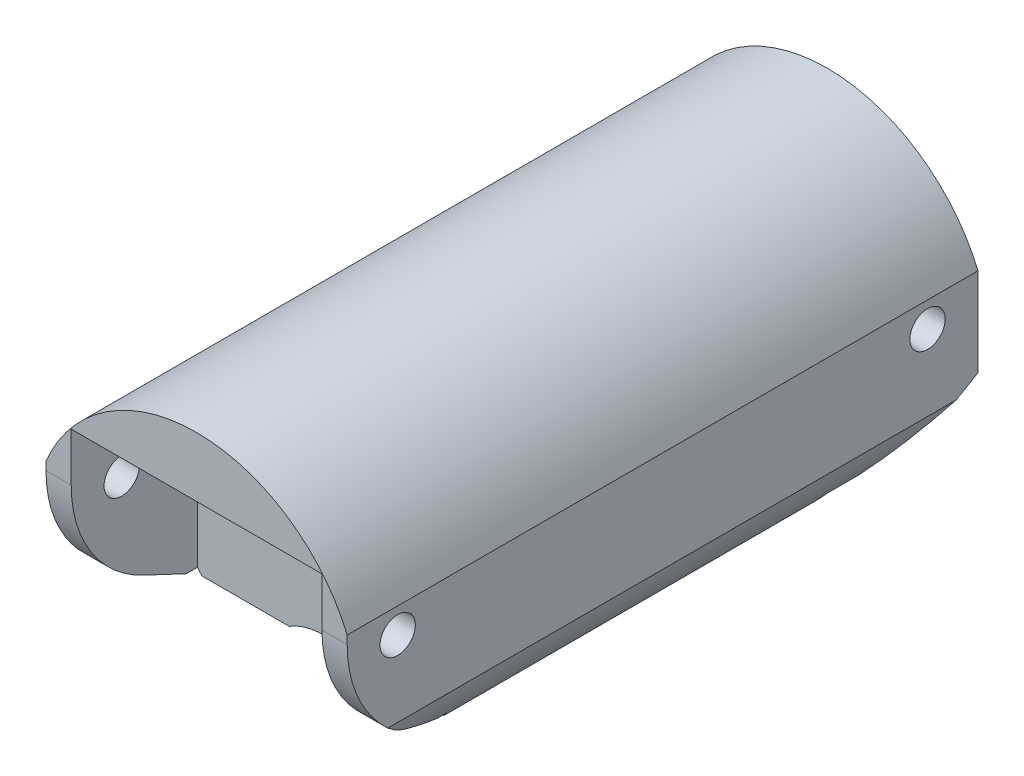
from build123d import *

# Parameters (mm, degrees)
BOSS_EXTRUDE1_DEPTH = 15.875
CUT_EXTRUDE1_DEPTH  = 25.170309552
CUT_EXTRUDE2_DEPTH  = 37.609435107
BOSS_EXTRUDE2_DEPTH = 15.15872
SKETCH6_W           = 12.61872
SKETCH6_H           = 6.35
CUT_EXTRUDE3_DEPTH  = 12.192
SKETCH7_R           = 0.889
CUT_EXTRUDE4_DEPTH  = 25.170309552
CUT_EXTRUDE5_DEPTH  = 15.875
FILLET1_R           = 6.35
CUT_EXTRUDE6_DEPTH  = 17.78
SKETCH10_W          = 0.284935898
SKETCH10_H          = 2.320192308
CUT_EXTRUDE7_DEPTH  = 1


with BuildPart() as part:
    # Sketch1 → Boss-Extrude1 (new, symmetric)
    with BuildSketch(Plane.XY):
        with BuildLine():
            Line((0, 0), (0, 5.08))
            ThreePointArc((0, 5.08), (7.57936, 10.11936), (15.15872, 5.08))
            Line((15.15872, 5.08), (15.15872, 0))
            ThreePointArc((15.15872, 0), (7.57936, -5.03936), (0, 0))
        make_face()
    extrude(amount=BOSS_EXTRUDE1_DEPTH, both=True)

    # Sketch2 → Cut-Extrude1 (cut, through all)
    with BuildSketch(Plane(origin=(0, 0, 0), x_dir=(0, 0, -1), z_dir=(1, 0, 0))):
        Polygon((-15.875, -5.03936), (-15.875, 0.635), (-3.81, -5.03936), align=None)
        Polygon((15.875, 0.635), (15.875, -5.03936), (6.04672018, -5.03936), align=None)
        with BuildLine():
            Line((-13.335, 1.27), (-15.875, 1.27))
            Line((-15.875, 1.27), (-15.875, 3.81))
            Line((-15.875, 3.81), (-13.335, 3.81))
            ThreePointArc((-13.335, 3.81), (-8.595295474, 2.54), (-13.335, 1.27))
        make_face()
        with BuildLine():
            Line((13.335, 1.27), (15.875, 1.27))
            Line((15.875, 1.27), (15.875, 3.81))
            Line((15.875, 3.81), (13.335, 3.81))
            ThreePointArc((13.335, 3.81), (8.595295474, 2.54), (13.335, 1.27))
        make_face()
    extrude(amount=CUT_EXTRUDE1_DEPTH, mode=Mode.SUBTRACT)

    # Sketch3 → Cut-Extrude2 (cut, through all)
    with BuildSketch(Plane.XY.offset(15.875)):
        with BuildLine():
            ThreePointArc((4.953709685, -3.254259045), (7.57936, -3.76936), (10.205010315, -3.254259045))
            ThreePointArc((10.205010315, -3.254259045), (7.57936, -1.86436), (4.953709685, -3.254259045))
        make_face()
    extrude(amount=-CUT_EXTRUDE2_DEPTH, mode=Mode.SUBTRACT)

    # Sketch4 → Boss-Extrude2 (add)
    with BuildSketch(Plane.ZY):
        with BuildLine():
            Line((15.875, 1.27), (13.335, 1.27))
            ThreePointArc((13.335, 1.27), (12.405295474, 0.340295474), (11.135295474, 0))
            ThreePointArc((11.135295474, 0), (8.595295474, 2.54), (11.135295474, 5.08))
            ThreePointArc((11.135295474, 5.08), (12.405295474, 4.739704526), (13.335, 3.81))
            Line((13.335, 3.81), (15.875, 3.81))
            Line((15.875, 3.81), (15.875, 1.27))
        make_face()
        with BuildLine():
            Line((-13.335, 1.27), (-15.875, 1.27))
            Line((-15.875, 1.27), (-15.875, 3.81))
            Line((-15.875, 3.81), (-13.335, 3.81))
            ThreePointArc((-13.335, 3.81), (-12.405295474, 4.739704526), (-11.135295474, 5.08))
            ThreePointArc((-11.135295474, 5.08), (-8.595295474, 2.54), (-11.135295474, 0))
            ThreePointArc((-11.135295474, 0), (-12.405295474, 0.340295474), (-13.335, 1.27))
        make_face()
    extrude(amount=-BOSS_EXTRUDE2_DEPTH)

    # Sketch6 → Cut-Extrude3 (cut)
    with BuildSketch(Plane(origin=(0, -5.08, 0), x_dir=(1, 0, 0), z_dir=(0, 1, 0))):
        with Locations((7.57936, -12.7)):
            Rectangle(SKETCH6_W, SKETCH6_H)
        with Locations((7.57936, 12.7)):
            Rectangle(SKETCH6_W, SKETCH6_H)
    extrude(amount=CUT_EXTRUDE3_DEPTH, mode=Mode.SUBTRACT)

    # Sketch7 → Cut-Extrude4 (cut, through all)
    with BuildSketch(Plane.ZY):
        with Locations((13.335, 3.81)):
            Circle(SKETCH7_R)
        with Locations(Location((-13.335, 3.81, 0), (0, 0, 180))):
            Circle(SKETCH7_R)
    extrude(amount=-CUT_EXTRUDE4_DEPTH, mode=Mode.SUBTRACT)

    # Sketch8 → Cut-Extrude5 (cut)
    with BuildSketch(Plane(origin=(0, 0, -9.525), x_dir=(-1, 0, 0), z_dir=(0, 0, -1))):
        with BuildLine():
            Line((-4.91236, 6.87324), (-5.54736, 6.87324))
            ThreePointArc((-5.54736, 6.87324), (-5.92836, 6.49224), (-5.54736, 6.11124))
            Line((-5.54736, 6.11124), (-4.91236, 6.11124))
            ThreePointArc((-4.91236, 6.11124), (-4.53136, 6.49224), (-4.91236, 6.87324))
        make_face()
    extrude(amount=-CUT_EXTRUDE5_DEPTH, mode=Mode.SUBTRACT)

    # Fillet1
    fillet1_edges = [part.edges().sort_by_distance(p)[0] for p in [
        (0.635, 0.635, 15.875),
        (14.52372, 0.635, 15.875),
    ]]
    fillet(fillet1_edges, radius=FILLET1_R)

    # Sketch9 → Cut-Extrude6 (cut)
    with BuildSketch(Plane.XY.offset(9.525)):
        with BuildLine():
            Line((9.61136, 6.767094737), (10.24636, 6.767094737))
            ThreePointArc((10.24636, 6.767094737), (10.62736, 6.386094737), (10.24636, 6.005094737))
            Line((10.24636, 6.005094737), (9.61136, 6.005094737))
            ThreePointArc((9.61136, 6.005094737), (9.23036, 6.386094737), (9.61136, 6.767094737))
        make_face()
    extrude(amount=-CUT_EXTRUDE6_DEPTH, mode=Mode.SUBTRACT)

    # Sketch10 → Cut-Extrude7 (cut)
    # profile 1 of 9: a face of its own
    with BuildSketch(Plane.ZY):
        with BuildLine():
            Line((-9.132963094, 3.918079484), (-8.510301836, 3.918079484))
            add(Edge.make_bspline(
                [(-8.510301836, 3.918079484), (-8.4674748, 3.918032407), (-8.385416296, 3.917942204), (-8.26774621, 3.915207399), (-8.160875953, 3.911554614), (-8.065035965, 3.90649104), (-7.979931362, 3.90050699), (-7.90594724, 3.892114069), (-7.842502071, 3.883350801), (-7.804486935, 3.874441382), (-7.787149793, 3.870378162)],
                knots=[0, 0, 0, 0, 1.415646017, 2.712440637, 3.8905458, 4.950247383, 5.884950622, 6.709939814, 7.411656543, 8, 8, 8, 8], degree=3))
            add(Edge.make_bspline(
                [(-7.787149793, 3.870378162), (-7.765202801, 3.864371107), (-7.721825972, 3.852498547), (-7.659322883, 3.828718955), (-7.59985618, 3.800522991), (-7.543221838, 3.768388417), (-7.490115805, 3.730936512), (-7.439745754, 3.689685445), (-7.3925562, 3.643682808), (-7.348812509, 3.593444565), (-7.308639871, 3.539814089), (-7.274050802, 3.48199078), (-7.245088246, 3.420947955), (-7.220247707, 3.356728073), (-7.202369323, 3.288791851), (-7.188901064, 3.217611333), (-7.180352488, 3.14319415), (-7.179533735, 3.092339841), (-7.17911694, 3.06645188)],
                knots=[0, 0, 0, 0, 0.999701418, 1.975846123, 2.934577507, 3.890451536, 4.834027766, 5.787354733, 6.749476667, 7.726910423, 8.712836071, 9.690891519, 10.682875813, 11.679750201, 12.712814741, 13.765529915, 14.8625177, 16, 16, 16, 16], degree=3))
            add(Edge.make_bspline(
                [(-7.17911694, 3.06645188), (-7.179499233, 3.040346325), (-7.180247213, 2.989269044), (-7.189224558, 2.914545158), (-7.201316946, 2.843136333), (-7.219910701, 2.775200902), (-7.244263561, 2.711142311), (-7.272831352, 2.649981622), (-7.30728784, 2.592759348), (-7.346879936, 2.539267748), (-7.390923168, 2.489456614), (-7.43923119, 2.443686907), (-7.491608977, 2.402226543), (-7.547890069, 2.364982574), (-7.608623146, 2.332818663), (-7.672887099, 2.304010251), (-7.74124051, 2.279815789), (-7.788541219, 2.267088519), (-7.812590498, 2.260617545)],
                knots=[0, 0, 0, 0, 1.121902311, 2.195077645, 3.232258892, 4.234102512, 5.217864754, 6.176164875, 7.132989551, 8.084763148, 9.034132444, 9.988522005, 10.94243251, 11.903244335, 12.886203696, 13.894208494, 14.929344452, 16, 16, 16, 16], degree=3))
            add(Edge.make_bspline(
                [(-7.812590498, 2.260617545), (-7.832481722, 2.256387555), (-7.876074497, 2.247117286), (-7.947868252, 2.236768186), (-8.031457281, 2.227934791), (-8.126727492, 2.221311616), (-8.23359337, 2.215641639), (-8.352112725, 2.211134868), (-8.482518209, 2.208658501), (-8.573478552, 2.208530781), (-8.620968903, 2.208464099)],
                knots=[0, 0, 0, 0, 0.601384939, 1.31797006, 2.144135048, 3.087295005, 4.142315834, 5.309527816, 6.595305764, 8, 8, 8, 8], degree=3))
            Line((-8.620968903, 2.208464099), (-8.848027196, 2.208464099))
            Line((-8.848027196, 2.208464099), (-8.848027196, 0.743079484))
            Line((-8.848027196, 0.743079484), (-9.132963094, 0.743079484))
            Line((-9.132963094, 0.743079484), (-9.132963094, 3.918079484))
        make_face()
        with BuildLine():
            Line((-8.848027196, 3.592438458), (-8.848027196, 2.534105125))
            Line((-8.848027196, 2.534105125), (-8.292147789, 2.527108931))
            add(Edge.make_bspline(
                [(-8.292147789, 2.527108931), (-8.265006142, 2.527094903), (-8.212609753, 2.527067823), (-8.136921179, 2.53068299), (-8.066699897, 2.534856331), (-8.002161603, 2.540966775), (-7.943277205, 2.549603916), (-7.889948519, 2.558323136), (-7.842589055, 2.570937286), (-7.78716335, 2.587921784), (-7.725402028, 2.616889229), (-7.65821218, 2.6589352), (-7.601270291, 2.712529843), (-7.551995836, 2.772789375), (-7.512892647, 2.839826443), (-7.484266854, 2.911553264), (-7.467447376, 2.987234242), (-7.465192043, 3.039021339), (-7.464052838, 3.065179845)],
                knots=[0, 0, 0, 0, 1.160613943, 2.240541288, 3.23993089, 4.169200891, 5.011653406, 5.7853311, 6.478053781, 7.106038997, 8.262395093, 9.384106736, 10.481365981, 11.59014053, 12.70357646, 13.786202915, 14.881775077, 16, 16, 16, 16], degree=3))
            add(Edge.make_bspline(
                [(-7.464052838, 3.065179845), (-7.465198238, 3.090705496), (-7.467475153, 3.141447332), (-7.484398686, 3.215813779), (-7.512836992, 3.28678474), (-7.552258332, 3.352981753), (-7.600102071, 3.413024453), (-7.655709332, 3.465182562), (-7.718949219, 3.507112249), (-7.777775829, 3.534175297), (-7.830028333, 3.550699154), (-7.875414468, 3.562260545), (-7.92665958, 3.571491274), (-7.983780352, 3.57896568), (-8.046334051, 3.585364177), (-8.114858094, 3.589705742), (-8.189092899, 3.592247063), (-8.240628202, 3.592373115), (-8.267343102, 3.592438458)],
                knots=[0, 0, 0, 0, 1.120700087, 2.227813068, 3.331159281, 4.466773991, 5.599788987, 6.693661531, 7.80175334, 8.91857717, 9.525282508, 10.207424825, 10.974604443, 11.810962634, 12.737642355, 13.736264703, 14.826523623, 16, 16, 16, 16], degree=3))
            Line((-8.267343102, 3.592438458), (-8.848027196, 3.592438458))
        make_face(mode=Mode.SUBTRACT)
    # profile 2 of 9: a face of its own
    with BuildSketch(Plane.ZY):
        with BuildLine():
            add(Edge.make_bspline(
                [(-5.488582084, 3.10397692), (-5.445047144, 3.103049919), (-5.359685765, 3.101232296), (-5.234674326, 3.081805863), (-5.115344095, 3.052099325), (-5.00123805, 3.011031551), (-4.893817553, 2.955984353), (-4.791517925, 2.890298782), (-4.694619638, 2.812481714), (-4.636541604, 2.752285467), (-4.607061652, 2.721730325)],
                knots=[0, 0, 0, 0, 1.054011418, 2.066658804, 3.057071809, 4.030435133, 4.997543892, 5.974964718, 6.972108034, 8, 8, 8, 8], degree=3))
            add(Edge.make_bspline(
                [(-4.607061652, 2.721730325), (-4.581678022, 2.692507638), (-4.531402005, 2.634627803), (-4.466935246, 2.540778783), (-4.411398545, 2.443587406), (-4.366891431, 2.341763046), (-4.331798588, 2.236194594), (-4.306883278, 2.126519198), (-4.292063344, 2.012979069), (-4.290064938, 1.935868444), (-4.289052838, 1.896815462)],
                knots=[0, 0, 0, 0, 1.025258237, 2.030674902, 3.01204498, 3.988269485, 4.97094183, 5.956517959, 6.965070386, 8, 8, 8, 8], degree=3))
            add(Edge.make_bspline(
                [(-4.289052838, 1.896815462), (-4.289943051, 1.857536124), (-4.291702153, 1.77991832), (-4.308342434, 1.665600752), (-4.334224205, 1.554752592), (-4.371264515, 1.447837919), (-4.4187608, 1.344529926), (-4.476718781, 1.245279835), (-4.545545176, 1.149891828), (-4.623563088, 1.059175875), (-4.709788718, 0.975567952), (-4.803329795, 0.902698736), (-4.902348098, 0.840267781), (-5.008160282, 0.789979033), (-5.119800074, 0.75032809), (-5.237508271, 0.72247879), (-5.361102014, 0.705640691), (-5.445490993, 0.70347845), (-5.488582084, 0.702374356)],
                knots=[0, 0, 0, 0, 0.998656419, 1.973391657, 2.932242238, 3.890759089, 4.846373663, 5.82037756, 6.809684879, 7.83454468, 8.860553229, 9.859544525, 10.845671541, 11.83227036, 12.833544569, 13.85385346, 14.904124723, 16, 16, 16, 16], degree=3))
            add(Edge.make_bspline(
                [(-5.488582084, 0.702374356), (-5.531884294, 0.703482155), (-5.61669386, 0.705651836), (-5.740723858, 0.722413371), (-5.858643012, 0.750315256), (-5.970428955, 0.790109338), (-6.076696066, 0.840269389), (-6.176288103, 0.902509993), (-6.269905169, 0.975589562), (-6.35614904, 1.059170019), (-6.434162061, 1.149893337), (-6.502989719, 1.245279443), (-6.560947372, 1.344530028), (-6.608443742, 1.447837892), (-6.64548403, 1.554752599), (-6.671365807, 1.66560075), (-6.688006085, 1.77991832), (-6.689765188, 1.857536124), (-6.690655402, 1.896815462)],
                knots=[0, 0, 0, 0, 1.099876186, 2.154163076, 3.173186993, 4.173200201, 5.163417411, 6.152872554, 7.150605724, 8.17532212, 9.198891216, 10.186952605, 11.159729845, 12.11414092, 13.071450619, 14.029093627, 15.002601286, 16, 16, 16, 16], degree=3))
            add(Edge.make_bspline(
                [(-6.690655402, 1.896815462), (-6.689636399, 1.935656185), (-6.687618948, 2.012554143), (-6.672813915, 2.125880834), (-6.647995796, 2.235370608), (-6.612860886, 2.340531576), (-6.567943534, 2.441909721), (-6.513187223, 2.539341247), (-6.448062863, 2.632765894), (-6.397986807, 2.690570924), (-6.372646588, 2.719822272)],
                knots=[0, 0, 0, 0, 1.031353054, 2.041901799, 3.029428768, 4.008703097, 4.981709435, 5.96992636, 6.972712378, 8, 8, 8, 8], degree=3))
            add(Edge.make_bspline(
                [(-6.372646588, 2.719822272), (-6.34321108, 2.750642396), (-6.285320975, 2.811255592), (-6.187940343, 2.88884581), (-6.085892377, 2.955898248), (-5.977284765, 3.009851672), (-5.863272459, 3.052340899), (-5.743330717, 3.081882474), (-5.617895071, 3.101162303), (-5.532115986, 3.103029364), (-5.488582084, 3.10397692)],
                knots=[0, 0, 0, 0, 1.027980169, 2.021703884, 2.998553061, 3.971491411, 4.943284454, 5.930300938, 6.949603206, 8, 8, 8, 8], degree=3))
        make_face()
        with BuildLine():
            add(Edge.make_bspline(
                [(-5.48985412, 2.819041022), (-5.520640381, 2.818166), (-5.581418162, 2.816438544), (-5.670880214, 2.803299573), (-5.757004497, 2.782482909), (-5.839954405, 2.752906372), (-5.919450212, 2.714716656), (-5.995568027, 2.667809787), (-6.06853174, 2.612807033), (-6.13691404, 2.549794467), (-6.199672281, 2.480961379), (-6.254534445, 2.407620368), (-6.301184363, 2.330961039), (-6.340046507, 2.250903676), (-6.368990885, 2.166636987), (-6.390012127, 2.079115271), (-6.403138702, 1.988160215), (-6.404849917, 1.926328434), (-6.405719504, 1.894907409)],
                knots=[0, 0, 0, 0, 1.021534396, 2.016698045, 2.994645724, 3.958388632, 4.93408049, 5.916473867, 6.921342795, 7.962252576, 8.998418191, 10.008913653, 10.997312074, 11.973003931, 12.956656626, 13.948281152, 14.957379055, 16, 16, 16, 16], degree=3))
            add(Edge.make_bspline(
                [(-6.405719504, 1.894907409), (-6.404261886, 1.854310927), (-6.401368785, 1.773734502), (-6.377841821, 1.655070126), (-6.338484267, 1.541149446), (-6.285337235, 1.432640296), (-6.218747308, 1.332244729), (-6.140291183, 1.242735597), (-6.050810883, 1.165459897), (-5.951373058, 1.101342273), (-5.844008784, 1.050397351), (-5.730383407, 1.014293995), (-5.611873635, 0.990824674), (-5.530883257, 0.988491979), (-5.48985412, 0.987310253)],
                knots=[0, 0, 0, 0, 1.016792936, 2.018143844, 3.017858371, 4.030088057, 5.03801393, 6.028138512, 7.003788237, 7.991172063, 8.984598303, 9.972568034, 10.972917682, 12, 12, 12, 12], degree=3))
            add(Edge.make_bspline(
                [(-5.48985412, 0.987310253), (-5.448827342, 0.988498865), (-5.367841623, 0.99084515), (-5.249496512, 1.014175794), (-5.136181695, 1.050555543), (-5.028928936, 1.101284977), (-4.929536375, 1.165703381), (-4.839412529, 1.242299238), (-4.761626289, 1.332481803), (-4.695102233, 1.432773276), (-4.641084831, 1.540981224), (-4.601911498, 1.655091152), (-4.578327973, 1.773729147), (-4.575442507, 1.854309133), (-4.573988735, 1.894907409)],
                knots=[0, 0, 0, 0, 1.02726834, 2.027799167, 3.010890988, 4.004497153, 4.992059811, 5.971914811, 6.958719428, 7.966827853, 8.981595046, 9.981490638, 10.983022906, 12, 12, 12, 12], degree=3))
            add(Edge.make_bspline(
                [(-4.573988735, 1.894907409), (-4.574858023, 1.926328622), (-4.576568648, 1.988160772), (-4.589699509, 2.079113141), (-4.610704891, 2.166644803), (-4.639707716, 2.250874835), (-4.678401, 2.331168321), (-4.725950519, 2.407395288), (-4.780588664, 2.48121544), (-4.844104195, 2.549571957), (-4.912415116, 2.612831598), (-4.985408401, 2.667831115), (-5.061413345, 2.714510505), (-5.140678203, 2.753233023), (-5.223638746, 2.782213825), (-5.309642356, 2.803419769), (-5.398722705, 2.816383019), (-5.459282694, 2.818149355), (-5.48985412, 2.819041022)],
                knots=[0, 0, 0, 0, 1.042956736, 2.052379634, 3.044323526, 4.02829302, 5.004299113, 5.996692471, 7.007513377, 8.048758398, 9.090003419, 10.095195979, 11.07790575, 12.047570684, 13.018257071, 13.989683339, 14.985167495, 16, 16, 16, 16], degree=3))
        make_face(mode=Mode.SUBTRACT)
    # profile 3 of 9: a face of its own
    with BuildSketch(Plane.ZY):
        with BuildLine():
            add(Edge.make_bspline(
                [(-3.618690257, 4.040194869), (-3.601008849, 4.039374673), (-3.566385257, 4.037768573), (-3.516317078, 4.024014947), (-3.470726789, 4.000701661), (-3.430288417, 3.969423665), (-3.395588491, 3.932639527), (-3.371294561, 3.889767077), (-3.355680459, 3.843449598), (-3.353794912, 3.811141624), (-3.352834889, 3.794692064)],
                knots=[0, 0, 0, 0, 1.055194115, 2.066272739, 3.074728998, 4.095836921, 5.109056067, 6.073838105, 7.019297344, 8, 8, 8, 8], degree=3))
            add(Edge.make_bspline(
                [(-3.352834889, 3.794692064), (-3.353816562, 3.778669514), (-3.355757215, 3.74699483), (-3.371282501, 3.701480323), (-3.395795531, 3.65920358), (-3.430266166, 3.622490865), (-3.470732685, 3.591230159), (-3.516315512, 3.567912289), (-3.566385669, 3.554159879), (-3.601008989, 3.552553611), (-3.618690257, 3.55173333)],
                knots=[0, 0, 0, 0, 0.96129708, 1.900370562, 2.859976407, 3.87933698, 4.906634145, 5.921202961, 6.938410037, 8, 8, 8, 8], degree=3))
            add(Edge.make_bspline(
                [(-3.618690257, 3.55173333), (-3.636169336, 3.552522291), (-3.670190078, 3.554057899), (-3.71950857, 3.56818213), (-3.764710129, 3.591238139), (-3.805227367, 3.622286178), (-3.839000471, 3.659429049), (-3.863582523, 3.701454523), (-3.879071953, 3.747001399), (-3.881017438, 3.778671721), (-3.882001555, 3.794692064)],
                knots=[0, 0, 0, 0, 1.054934014, 2.053291228, 3.073705704, 4.106921865, 5.123545215, 6.088680038, 7.033164197, 8, 8, 8, 8], degree=3))
            add(Edge.make_bspline(
                [(-3.882001555, 3.794692064), (-3.881038998, 3.811139335), (-3.879148475, 3.843442812), (-3.863570913, 3.889793306), (-3.83920523, 3.93241224), (-3.805205005, 3.969628229), (-3.76471608, 4.00069373), (-3.719507033, 4.023745121), (-3.670190484, 4.03787055), (-3.636169473, 4.039405993), (-3.618690257, 4.040194869)],
                knots=[0, 0, 0, 0, 0.98631895, 1.937192651, 2.907499808, 3.917963147, 4.944918757, 5.95915025, 6.951458133, 8, 8, 8, 8], degree=3))
        make_face()
    # profile 4 of 9: a face of its own
    with BuildSketch(Plane.ZY):
        with Locations((-3.617418222, 1.903175638)):
            Rectangle(SKETCH10_W, SKETCH10_H)
    # profile 5 of 9: a face of its own
    with BuildSketch(Plane.ZY):
        with BuildLine():
            Line((-2.782963094, 3.063271792), (-2.498027196, 3.063271792))
            Line((-2.498027196, 3.063271792), (-2.498027196, 2.644772192))
            add(Edge.make_bspline(
                [(-2.498027196, 2.644772192), (-2.46760377, 2.682729519), (-2.40856605, 2.756387037), (-2.310245977, 2.853197844), (-2.206338296, 2.932976727), (-2.097479335, 2.996570883), (-1.983521319, 3.044510322), (-1.865158888, 3.079132274), (-1.741683405, 3.099892083), (-1.657714237, 3.102604649), (-1.615234729, 3.10397692)],
                knots=[0, 0, 0, 0, 1.12780773, 2.188550248, 3.19190651, 4.159438251, 5.104880172, 6.052711206, 7.014878035, 8, 8, 8, 8], degree=3))
            add(Edge.make_bspline(
                [(-1.615234729, 3.10397692), (-1.572299082, 3.102393778), (-1.488263665, 3.099295188), (-1.365909995, 3.07478719), (-1.25163413, 3.032926851), (-1.145843533, 2.975584473), (-1.050478133, 2.904277172), (-0.966726303, 2.821203042), (-0.897453929, 2.725648166), (-0.851010607, 2.636999303), (-0.820416626, 2.558360183), (-0.801155863, 2.491007774), (-0.784799187, 2.415970594), (-0.770618958, 2.333475395), (-0.761024007, 2.24294418), (-0.753456357, 2.144748059), (-0.748032827, 2.03891884), (-0.747817646, 1.965724543), (-0.747706684, 1.927980325)],
                knots=[0, 0, 0, 0, 1.235846778, 2.418850247, 3.575807741, 4.728682307, 5.871620074, 6.994088408, 8.11269785, 9.256955736, 9.865816715, 10.540099792, 11.271859618, 12.076849838, 12.949306005, 13.892391288, 14.913166135, 16, 16, 16, 16], degree=3))
            Line((-0.747706684, 1.927980325), (-0.747706684, 0.743079484))
            Line((-0.747706684, 0.743079484), (-1.032642581, 0.743079484))
            Line((-1.032642581, 0.743079484), (-1.032642581, 1.834485734))
            add(Edge.make_bspline(
                [(-1.032642581, 1.834485734), (-1.032817848, 1.866074666), (-1.033153105, 1.926498917), (-1.034210513, 2.013012246), (-1.036759409, 2.091467927), (-1.040341093, 2.161678396), (-1.045583499, 2.223576234), (-1.051046886, 2.277287506), (-1.057727972, 2.32274402), (-1.063681472, 2.350108059), (-1.066351515, 2.362380365)],
                knots=[0, 0, 0, 0, 1.430800155, 2.736877192, 3.918605307, 4.986035426, 5.920637409, 6.731861385, 7.431261377, 8, 8, 8, 8], degree=3))
            add(Edge.make_bspline(
                [(-1.066351515, 2.362380365), (-1.07599039, 2.398404083), (-1.094542243, 2.467738594), (-1.140383784, 2.561786043), (-1.198272363, 2.641794399), (-1.26893684, 2.707268996), (-1.351694645, 2.75822397), (-1.446316124, 2.793578914), (-1.551888177, 2.815691673), (-1.626141795, 2.817893428), (-1.664844104, 2.819041022)],
                knots=[0, 0, 0, 0, 1.084156227, 2.086665306, 3.027808233, 3.945421172, 4.874247719, 5.839848303, 6.874090471, 8, 8, 8, 8], degree=3))
            add(Edge.make_bspline(
                [(-1.664844104, 2.819041022), (-1.687765502, 2.818609218), (-1.733126358, 2.817754689), (-1.800390975, 2.809181011), (-1.865636475, 2.795157984), (-1.929517665, 2.776227148), (-1.990756878, 2.750226375), (-2.051321628, 2.72071759), (-2.108931335, 2.683934569), (-2.164814417, 2.642940219), (-2.216805321, 2.597511224), (-2.265181742, 2.549573704), (-2.308305518, 2.498523692), (-2.347374959, 2.44518374), (-2.381100955, 2.388821287), (-2.410540542, 2.329980095), (-2.435519351, 2.268582717), (-2.447931508, 2.225969625), (-2.45414198, 2.204647994)],
                knots=[0, 0, 0, 0, 1.023777757, 2.026029729, 3.023749952, 4.003683103, 4.997618607, 5.993177895, 7.010360494, 8.046726602, 9.087585522, 10.09234134, 11.086953743, 12.070360549, 13.043493632, 14.017870808, 15.008233677, 16, 16, 16, 16], degree=3))
            add(Edge.make_bspline(
                [(-2.45414198, 2.204647994), (-2.457715804, 2.188995059), (-2.465495832, 2.15491944), (-2.47389886, 2.098999146), (-2.481525732, 2.034310811), (-2.487909258, 1.960929924), (-2.491814886, 1.878599566), (-2.496073375, 1.787671341), (-2.497623737, 1.687782677), (-2.497888944, 1.61823957), (-2.498027196, 1.581986736)],
                knots=[0, 0, 0, 0, 0.615963638, 1.340920617, 2.168419149, 3.115676021, 4.16674242, 5.331190069, 6.6087489, 8, 8, 8, 8], degree=3))
            Line((-2.498027196, 1.581986736), (-2.498027196, 0.743079484))
            Line((-2.498027196, 0.743079484), (-2.782963094, 0.743079484))
            Line((-2.782963094, 0.743079484), (-2.782963094, 3.063271792))
        make_face()
    # profile 6 of 9: a face of its own
    with BuildSketch(Plane.ZY):
        Polygon((0.188511265, 3.99948974), (0.473447162, 3.99948974), (0.473447162, 3.063271792), (0.880498445, 3.063271792), (0.880498445, 2.778335894), (0.473447162, 2.778335894), (0.473447162, 0.743079484), (0.188511265, 0.743079484), (0.188511265, 2.778335894), (-0.218540017, 2.778335894), (-0.218540017, 3.063271792), (0.188511265, 3.063271792), align=None)
    # profile 7 of 9: a face of its own
    with BuildSketch(Plane.ZY):
        with BuildLine():
            Line((3.273196762, 1.475771792), (3.526331778, 1.342844107))
            add(Edge.make_bspline(
                [(3.526331778, 1.342844107), (3.506160009, 1.307063371), (3.466913736, 1.237448228), (3.399421629, 1.141806469), (3.328671677, 1.055766041), (3.251470221, 0.981625569), (3.170127012, 0.916990384), (3.084190961, 0.860441071), (2.993214676, 0.812254985), (2.897193854, 0.771658049), (2.795322119, 0.740443722), (2.6873526, 0.718396322), (2.573078458, 0.704768071), (2.494750138, 0.703184979), (2.454642074, 0.702374356)],
                knots=[0, 0, 0, 0, 1.120438281, 2.179929193, 3.190490725, 4.156257408, 5.095198341, 6.022838206, 6.959905092, 7.901321166, 8.864066838, 9.862729781, 10.905609505, 12, 12, 12, 12], degree=3))
            add(Edge.make_bspline(
                [(2.454642074, 0.702374356), (2.41006328, 0.703415008), (2.323102968, 0.705445018), (2.196520483, 0.722946039), (2.077340582, 0.751495965), (1.965569966, 0.791378992), (1.861482351, 0.843473779), (1.764870861, 0.906937023), (1.675227434, 0.981442711), (1.595376901, 1.067636199), (1.523491379, 1.15987626), (1.460058671, 1.255993384), (1.40702943, 1.355745738), (1.363892419, 1.458498284), (1.32905372, 1.563603388), (1.304772496, 1.672017362), (1.290775511, 1.783446785), (1.288630621, 1.858827939), (1.287549727, 1.896815462)],
                knots=[0, 0, 0, 0, 1.145258523, 2.234067595, 3.276747158, 4.290159414, 5.277019952, 6.260822364, 7.254936242, 8.264827045, 9.274100331, 10.257902744, 11.220704747, 12.172965371, 13.118907548, 14.062713208, 15.023725156, 16, 16, 16, 16], degree=3))
            add(Edge.make_bspline(
                [(1.287549727, 1.896815462), (1.288510519, 1.932461486), (1.290414683, 2.0031072), (1.302416897, 2.107669515), (1.323687849, 2.209295326), (1.352876371, 2.308069075), (1.390569287, 2.403825382), (1.436681372, 2.496622526), (1.491284458, 2.58636176), (1.533441812, 2.642970317), (1.55467713, 2.671484933)],
                knots=[0, 0, 0, 0, 1.024358464, 2.0301432, 3.019427413, 4.004406732, 4.986367066, 5.972626655, 6.978780325, 8, 8, 8, 8], degree=3))
            add(Edge.make_bspline(
                [(1.55467713, 2.671484933), (1.583440528, 2.705837408), (1.640056173, 2.773454158), (1.735810867, 2.862298211), (1.839497473, 2.936723636), (1.949816591, 2.998415824), (2.068050393, 3.045291203), (2.192609535, 3.080223081), (2.324912317, 3.09979742), (2.415359196, 3.102562241), (2.461638268, 3.10397692)],
                knots=[0, 0, 0, 0, 1.030682036, 2.02871468, 2.997146059, 3.962720338, 4.930598197, 5.918074684, 6.934738563, 8, 8, 8, 8], degree=3))
            add(Edge.make_bspline(
                [(2.461638268, 3.10397692), (2.509215739, 3.102748604), (2.60255189, 3.100338929), (2.738652457, 3.077999326), (2.867431107, 3.04257308), (2.988836308, 2.992540713), (3.102880367, 2.927988834), (3.208821998, 2.848031592), (3.308473013, 2.755123756), (3.366447224, 2.683674273), (3.395948164, 2.647316263)],
                knots=[0, 0, 0, 0, 1.056321875, 2.072262726, 3.055038591, 4.01806755, 4.982017516, 5.957941055, 6.960871419, 8, 8, 8, 8], degree=3))
            add(Edge.make_bspline(
                [(3.395948164, 2.647316263), (3.416020458, 2.6199173), (3.456031439, 2.565301749), (3.506148451, 2.476246485), (3.549652659, 2.383073303), (3.584426131, 2.284276105), (3.612583393, 2.181025486), (3.632954936, 2.07258332), (3.644901661, 1.958981901), (3.64724998, 1.881578526), (3.648447162, 1.842117946)],
                knots=[0, 0, 0, 0, 0.94817472, 1.890038105, 2.849395472, 3.817997239, 4.812318967, 5.836947057, 6.897266129, 8, 8, 8, 8], degree=3))
            Line((3.648447162, 1.842117946), (1.572485624, 1.842117946))
            add(Edge.make_bspline(
                [(1.572485624, 1.842117946), (1.573882267, 1.81154681), (1.576628709, 1.751429905), (1.58943316, 1.663463552), (1.609615977, 1.579667735), (1.637981483, 1.500670975), (1.672332122, 1.425441502), (1.714410593, 1.354537369), (1.764611474, 1.288281532), (1.820605502, 1.226081343), (1.882932652, 1.17069051), (1.94850343, 1.121113541), (2.018256879, 1.079561321), (2.091642997, 1.04583385), (2.168543116, 1.019430263), (2.248981465, 1.001407312), (2.332799756, 0.989335865), (2.389936815, 0.987993597), (2.419025087, 0.987310253)],
                knots=[0, 0, 0, 0, 1.094153842, 2.151609401, 3.174256925, 4.172055639, 5.149267565, 6.128595816, 7.11444997, 8.118368179, 9.117203808, 10.09244225, 11.054858984, 12.015122123, 12.976791628, 13.957293641, 14.960065497, 16, 16, 16, 16], degree=3))
            add(Edge.make_bspline(
                [(2.419025087, 0.987310253), (2.447465057, 0.987861847), (2.503895412, 0.988956316), (2.587933904, 0.999598835), (2.670610475, 1.016807585), (2.751582939, 1.040293505), (2.82920792, 1.068938221), (2.901094955, 1.103502956), (2.967207722, 1.141738798), (3.028999542, 1.18547186), (3.088935372, 1.239000715), (3.14839177, 1.305798834), (3.212142734, 1.384799663), (3.252047579, 1.444258945), (3.273196762, 1.475771792)],
                knots=[0, 0, 0, 0, 0.99110716, 1.966546729, 2.947904876, 3.932708344, 4.903319531, 5.828989031, 6.710028674, 7.56322171, 8.463672341, 9.504779593, 10.677557249, 12, 12, 12, 12], degree=3))
        make_face()
        with BuildLine():
            add(Edge.make_bspline(
                [(3.363511265, 2.127053843), (3.353082184, 2.164848021), (3.333009561, 2.237589648), (3.291066573, 2.338319599), (3.243830247, 2.427843624), (3.187930533, 2.505476576), (3.124594975, 2.57442262), (3.051438274, 2.634673765), (2.969399999, 2.688573882), (2.878904207, 2.734069363), (2.783072016, 2.772795164), (2.682736399, 2.798762233), (2.580358263, 2.816550889), (2.51111216, 2.818207431), (2.476266674, 2.819041022)],
                knots=[0, 0, 0, 0, 1.154881502, 2.222775134, 3.210006277, 4.132804581, 5.035138423, 5.962687519, 6.919655026, 7.923214229, 8.944639381, 9.960483929, 10.97369054, 12, 12, 12, 12], degree=3))
            add(Edge.make_bspline(
                [(2.476266674, 2.819041022), (2.447828254, 2.818486149), (2.391611479, 2.817389281), (2.308788367, 2.806984235), (2.229250354, 2.789784947), (2.152410557, 2.766231022), (2.079275913, 2.734836076), (2.008342087, 2.698021291), (1.941412728, 2.653079998), (1.899555981, 2.618827322), (1.878410103, 2.601522994)],
                knots=[0, 0, 0, 0, 1.04873581, 2.073130211, 3.073294108, 4.04793562, 5.032784715, 6.005352987, 6.992311501, 8, 8, 8, 8], degree=3))
            add(Edge.make_bspline(
                [(1.878410103, 2.601522994), (1.863266912, 2.587830293), (1.832620783, 2.560119604), (1.791671881, 2.512377395), (1.752464738, 2.460895621), (1.716783496, 2.403704687), (1.684055971, 2.341455837), (1.653430849, 2.274674125), (1.625866032, 2.202852786), (1.610357418, 2.152803501), (1.602378453, 2.127053843)],
                knots=[0, 0, 0, 0, 0.879870761, 1.780643979, 2.707998968, 3.669668524, 4.684282772, 5.740141944, 6.837334558, 8, 8, 8, 8], degree=3))
            Line((1.602378453, 2.127053843), (3.363511265, 2.127053843))
        make_face(mode=Mode.SUBTRACT)
    # profile 8 of 9: a face of its own
    with BuildSketch(Plane.ZY):
        with BuildLine():
            Line((4.136908701, 3.063271792), (4.421844598, 3.063271792))
            Line((4.421844598, 3.063271792), (4.421844598, 2.721730325))
            add(Edge.make_bspline(
                [(4.421844598, 2.721730325), (4.442880115, 2.75353097), (4.483110378, 2.814349455), (4.549978535, 2.894785178), (4.618470843, 2.961383113), (4.688915191, 3.014454162), (4.761829611, 3.05419892), (4.835613845, 3.083311887), (4.911428736, 3.100527023), (4.962375624, 3.102825414), (4.987900287, 3.10397692)],
                knots=[0, 0, 0, 0, 1.2804753, 2.448899062, 3.506932113, 4.484331642, 5.4025378, 6.288909075, 7.142734305, 8, 8, 8, 8], degree=3))
            add(Edge.make_bspline(
                [(4.987900287, 3.10397692), (5.007699884, 3.102896942), (5.04843884, 3.100674818), (5.11010876, 3.085062141), (5.173648177, 3.060135649), (5.214598772, 3.036694876), (5.235947162, 3.024474716)],
                knots=[0, 0, 0, 0, 0.901110191, 1.854092781, 2.881294221, 4, 4, 4, 4], degree=3))
            Line((5.235947162, 3.024474716), (5.079486826, 2.777699877))
            add(Edge.make_bspline(
                [(5.079486826, 2.777699877), (5.065780785, 2.783814261), (5.039764096, 2.795420533), (5.001705311, 2.809156499), (4.966615813, 2.817244508), (4.944260585, 2.818469802), (4.933838789, 2.819041022)],
                knots=[0, 0, 0, 0, 1.180555205, 2.24091978, 3.179933427, 4, 4, 4, 4], degree=3))
            add(Edge.make_bspline(
                [(4.933838789, 2.819041022), (4.910973588, 2.817516989), (4.864335206, 2.814408401), (4.795859981, 2.789971054), (4.729414302, 2.750487443), (4.676644294, 2.706698649), (4.635784536, 2.664473147), (4.60662876, 2.627599239), (4.579883697, 2.586252909), (4.554329282, 2.541140982), (4.531046287, 2.491493193), (4.50931598, 2.437805563), (4.489668297, 2.380015911), (4.478464861, 2.339754625), (4.472726009, 2.319131167)],
                knots=[0, 0, 0, 0, 1.125678352, 2.296057538, 3.5422874, 4.923748041, 5.663163013, 6.437101912, 7.23742474, 8.08941207, 8.991984279, 9.93940061, 10.944477711, 12, 12, 12, 12], degree=3))
            add(Edge.make_bspline(
                [(4.472726009, 2.319131167), (4.468433052, 2.300736873), (4.458924479, 2.259994912), (4.449679298, 2.191643036), (4.440544807, 2.11088586), (4.43410716, 2.017498593), (4.428139936, 1.911714448), (4.424774361, 1.793372269), (4.42195937, 1.662350586), (4.421884016, 1.570752422), (4.421844598, 1.522837096)],
                knots=[0, 0, 0, 0, 0.566838948, 1.255505196, 2.06880316, 3.007127437, 4.065329342, 5.249902469, 6.561414163, 8, 8, 8, 8], degree=3))
            Line((4.421844598, 1.522837096), (4.421844598, 0.743079484))
            Line((4.421844598, 0.743079484), (4.136908701, 0.743079484))
            Line((4.136908701, 0.743079484), (4.136908701, 3.063271792))
        make_face()
    # profile 9 of 9: a face of its own
    with BuildSketch(Plane.ZY):
        with BuildLine():
            Line((6.945562547, 2.941156407), (6.66062665, 2.941156407))
            add(Edge.make_bspline(
                [(6.66062665, 2.941156407), (6.66248371, 2.978957855), (6.666130927, 3.053198893), (6.683210875, 3.161442723), (6.707650099, 3.264906719), (6.74220449, 3.362760141), (6.785118042, 3.455868202), (6.836580281, 3.543861073), (6.897534702, 3.62640308), (6.966665097, 3.702729031), (7.041748076, 3.772749184), (7.122761322, 3.833215012), (7.207892168, 3.884303185), (7.296882337, 3.927012597), (7.390735848, 3.959070886), (7.488601012, 3.982857659), (7.5909078, 3.997169058), (7.660612677, 3.998707378), (7.696063348, 3.99948974)],
                knots=[0, 0, 0, 0, 1.10065271, 2.161652631, 3.183658789, 4.190468796, 5.17591951, 6.163126047, 7.15150782, 8.156236427, 9.156009102, 10.134482811, 11.092018607, 12.041330605, 13.001268258, 13.972401359, 14.968799086, 16, 16, 16, 16], degree=3))
            add(Edge.make_bspline(
                [(7.696063348, 3.99948974), (7.730877744, 3.998674712), (7.799286788, 3.99707321), (7.899128759, 3.983319991), (7.994176733, 3.961779347), (8.084244921, 3.931557505), (8.168614708, 3.890931632), (8.247919899, 3.842129579), (8.323104634, 3.785687303), (8.390783645, 3.71923563), (8.45293026, 3.648294895), (8.506544448, 3.57255944), (8.552457818, 3.494337159), (8.59072807, 3.413031576), (8.618900425, 3.327877143), (8.640289228, 3.240113609), (8.652379096, 3.148832531), (8.654234587, 3.087050155), (8.655177932, 3.05563958)],
                knots=[0, 0, 0, 0, 1.111607364, 2.184268762, 3.212621178, 4.221274766, 5.211760367, 6.196651075, 7.1921475, 8.207485113, 9.220403448, 10.201281604, 11.166441695, 12.114753415, 13.065576456, 14.026450734, 14.996634279, 16, 16, 16, 16], degree=3))
            add(Edge.make_bspline(
                [(8.655177932, 3.05563958), (8.6536419, 3.01141833), (8.650596793, 2.923751851), (8.624548751, 2.794924082), (8.583866559, 2.670107195), (8.534883243, 2.569652642), (8.485468954, 2.488705116), (8.440939572, 2.422058505), (8.388810779, 2.350298544), (8.328323856, 2.273665531), (8.260730036, 2.19155921), (8.185417074, 2.104029181), (8.101847915, 2.01197979), (8.043193418, 1.949109709), (8.012800127, 1.916532008)],
                knots=[0, 0, 0, 0, 1.184426356, 2.348067706, 3.509069118, 4.696110526, 5.333549288, 6.050745305, 6.844228056, 7.710549037, 8.667450064, 9.695053472, 10.805634456, 12, 12, 12, 12], degree=3))
            Line((8.012800127, 1.916532008), (7.21841411, 1.06872051))
            Line((7.21841411, 1.06872051), (8.69588306, 1.06872051))
            Line((8.69588306, 1.06872051), (8.69588306, 0.743079484))
            Line((8.69588306, 0.743079484), (6.538511265, 0.743079484))
            Line((6.538511265, 0.743079484), (7.769841393, 2.057091904))
            add(Edge.make_bspline(
                [(7.769841393, 2.057091904), (7.799820548, 2.088386796), (7.857404368, 2.14849788), (7.938849991, 2.236257565), (8.012001074, 2.31767322), (8.077331137, 2.392591017), (8.13342296, 2.462106797), (8.183199913, 2.523969135), (8.223082985, 2.580896386), (8.266367665, 2.646882515), (8.308290348, 2.727447974), (8.344315128, 2.825903535), (8.366281455, 2.927256114), (8.368916556, 2.995747248), (8.370242034, 3.030198875)],
                knots=[0, 0, 0, 0, 1.329631726, 2.553950428, 3.673215718, 4.687767853, 5.603093632, 6.413772471, 7.123043292, 7.734684054, 8.834405432, 9.900288307, 10.943827018, 12, 12, 12, 12], degree=3))
            add(Edge.make_bspline(
                [(8.370242034, 3.030198875), (8.369665325, 3.051862715), (8.368528742, 3.094557984), (8.358497831, 3.157156065), (8.343339015, 3.21753986), (8.321617245, 3.275895108), (8.292945416, 3.331635092), (8.258044565, 3.384827663), (8.217776436, 3.436252653), (8.171193499, 3.484470288), (8.120020191, 3.528631096), (8.065959693, 3.567750802), (8.008764242, 3.600443424), (7.948674988, 3.627243596), (7.885859455, 3.648266978), (7.820196151, 3.662834403), (7.751866507, 3.671980657), (7.705208979, 3.673218155), (7.681434943, 3.673848715)],
                knots=[0, 0, 0, 0, 0.991446411, 1.95395049, 2.89581595, 3.838931463, 4.798493298, 5.75982156, 6.748411868, 7.785213223, 8.824556874, 9.840280684, 10.836137867, 11.835679398, 12.848801643, 13.863922112, 14.911575587, 16, 16, 16, 16], degree=3))
            add(Edge.make_bspline(
                [(7.681434943, 3.673848715), (7.656605688, 3.673200078), (7.60784513, 3.671926264), (7.536254292, 3.663015704), (7.467959337, 3.647643406), (7.402788468, 3.626618851), (7.340631415, 3.599895739), (7.281790461, 3.566611085), (7.226397697, 3.526893202), (7.174348994, 3.481862126), (7.126393813, 3.431726516), (7.084259861, 3.375837478), (7.047444363, 3.315215466), (7.015323129, 3.250024052), (6.989237611, 3.179671695), (6.969304824, 3.104408134), (6.95353247, 3.024560166), (6.948263312, 2.969419411), (6.945562547, 2.941156407)],
                knots=[0, 0, 0, 0, 1.031018746, 2.02475058, 2.990194455, 3.934040569, 4.864654155, 5.795059489, 6.735614925, 7.690564532, 8.649604399, 9.611025574, 10.590972636, 11.591080095, 12.624614302, 13.701020113, 14.821632451, 16, 16, 16, 16], degree=3))
        make_face()
    extrude(amount=-CUT_EXTRUDE7_DEPTH, mode=Mode.SUBTRACT)


solid = part.part
